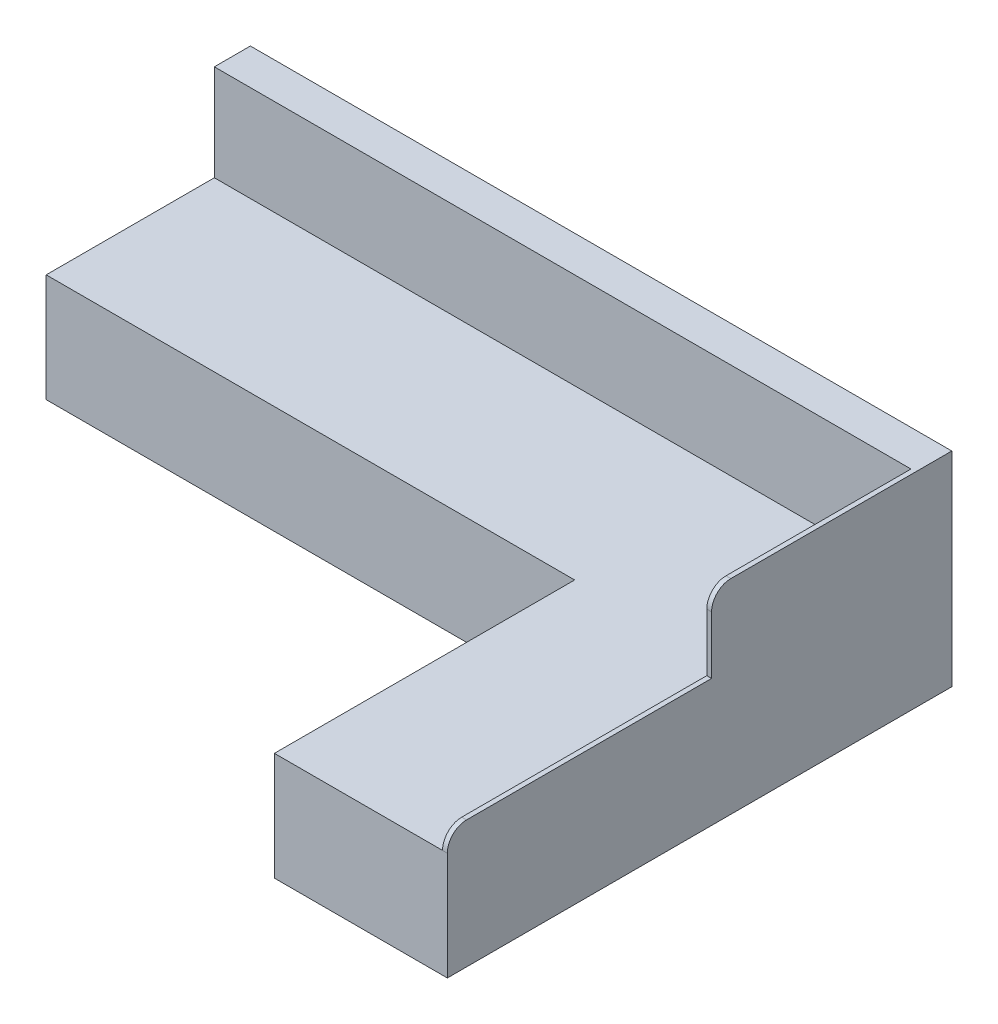
from build123d import *

# Parameters (mm, degrees)
BOSS_EXTRUDE1_DEPTH = 450
SKETCH3_W           = 2900
SKETCH3_H           = 150
BOSS_EXTRUDE3_DEPTH = 400
BOSS_EXTRUDE4_DEPTH = 20


with BuildPart() as part:
    # Sketch1 → Boss-Extrude1 (new body)
    with BuildSketch(Plane(origin=(0, 0, 0), x_dir=(1, 0, 0), z_dir=(0, 1, 0))):
        Polygon((750, -425), (750, -1675), (1450, -1675), (1450, 425), (-1450, 425), (-1450, -425), align=None)
    extrude(amount=BOSS_EXTRUDE1_DEPTH)

    # Sketch3 → Boss-Extrude3 (add)
    with BuildSketch(Plane(origin=(0, 450, 0), x_dir=(1, 0, 0), z_dir=(0, 1, 0))):
        with Locations((0, 350)):
            Rectangle(SKETCH3_W, SKETCH3_H)
    extrude(amount=BOSS_EXTRUDE3_DEPTH)

    # Sketch5 → Boss-Extrude4 (add)
    with BuildSketch(Plane(origin=(1450, 0, 0), x_dir=(0, 0, -1), z_dir=(1, 0, 0))):
        with BuildLine():
            Line((-575, 770), (-575, 530))
            Line((-575, 530), (-1595, 530))
            ThreePointArc((-1595, 530), (-1651.568542495, 506.568542495), (-1675, 450))
            Line((-1675, 450), (-1675, 0))
            Line((-1675, 0), (425, 0))
            Line((425, 0), (425, 850))
            Line((425, 850), (-495, 850))
            ThreePointArc((-495, 850), (-551.568542495, 826.568542495), (-575, 770))
        make_face()
    extrude(amount=BOSS_EXTRUDE4_DEPTH)


solid = part.part
